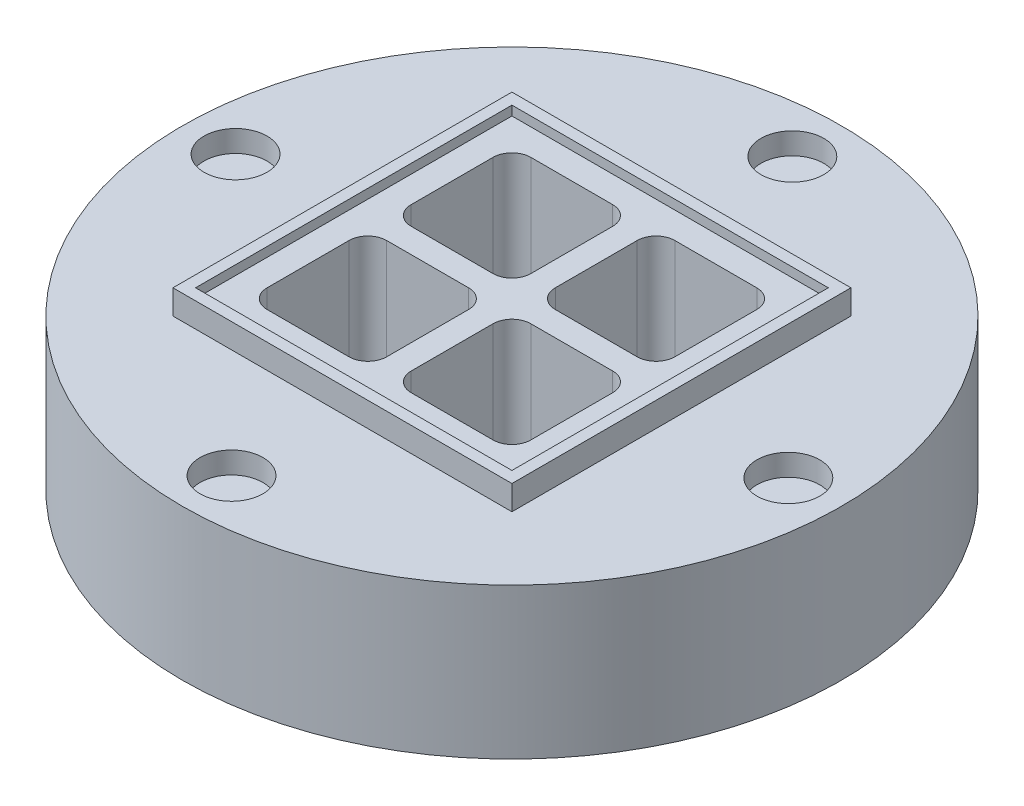
from build123d import *

# Parameters (mm, degrees)
SKETCH1_R           = 17.5
BOSS_EXTRUDE1_DEPTH = 8
SKETCH5_R           = 16.5
CUT_EXTRUDE2_DEPTH  = 1
SKETCH11_R          = 1.67
CUT_EXTRUDE5_DEPTH  = 1.15
CIRPATTERN1_COUNT   = 4
SKETCH13_W          = 18
SKETCH13_H          = 18
SKETCH13_W_2        = 16.8
SKETCH13_H_2        = 16.8
BOSS_EXTRUDE3_DEPTH = 1.3
SKETCH12_W          = 18
SKETCH12_H          = 18
SKETCH12_W_2        = 14
SKETCH12_H_2        = 14
SKETCH12_W_3        = 6.349092008
SKETCH12_H_3        = 1.301815984
SKETCH12_W_4        = 1.301815984
SKETCH12_H_4        = 6.349092008
BOSS_EXTRUDE2_DEPTH = 0.8
SKETCH14_W          = 6.349092008
SKETCH14_H          = 6.349092008
CUT_EXTRUDE6_DEPTH  = 27.009613607
FILLET1_R           = 1


with BuildPart() as part:
    # Sketch1 → Boss-Extrude1 (new body)
    with BuildSketch(Plane(origin=(0, 0, 0), x_dir=(1, 0, 0), z_dir=(0, 1, 0))):
        with Locations(Location((0, 0, 0), (0, 0, 270))):
            Circle(SKETCH1_R)
    extrude(amount=BOSS_EXTRUDE1_DEPTH)

    # Sketch5 → Cut-Extrude2 (cut)
    with BuildSketch(Plane.XZ):
        with Locations(Location((0, 0, 0), (0, 0, 270))):
            Circle(SKETCH5_R)
    extrude(amount=-CUT_EXTRUDE2_DEPTH, mode=Mode.SUBTRACT)

    # Sketch11 → Cut-Extrude5 (cut)
    with BuildSketch(Plane(origin=(0, 8, 0), x_dir=(1, 0, 0), z_dir=(0, 1, 0))):
        with Locations(Location((0.106708516, 14.783412681, 0), (0, 0, 270))):
            Circle(SKETCH11_R)
    cut_extrude5 = extrude(amount=-CUT_EXTRUDE5_DEPTH, mode=Mode.SUBTRACT)

    # CirPattern1: Cut-Extrude5 ×4 about axis
    cirpattern1_axis = Axis((0, 0, 0), (0, 1, 0))
    for i in range(1, CIRPATTERN1_COUNT):
        add(cut_extrude5.rotate(cirpattern1_axis, i * 360 / CIRPATTERN1_COUNT), mode=Mode.SUBTRACT)

    # Sketch13 → Boss-Extrude3 (add)
    with BuildSketch(Plane(origin=(0, 8, 0), x_dir=(1, 0, 0), z_dir=(0, 1, 0))):
        Rectangle(SKETCH13_W, SKETCH13_H)
        Rectangle(SKETCH13_W_2, SKETCH13_H_2, mode=Mode.SUBTRACT)
    extrude(amount=BOSS_EXTRUDE3_DEPTH)

    # Sketch12 → Boss-Extrude2 (add)
    # profile 1 of 6: a face of its own
    with BuildSketch(Plane(origin=(0, 8, 0), x_dir=(1, 0, 0), z_dir=(0, 1, 0))):
        Rectangle(SKETCH12_W, SKETCH12_H)
        Rectangle(SKETCH12_W_2, SKETCH12_H_2, mode=Mode.SUBTRACT)
    # profile 2 of 6: a face of its own
    with BuildSketch(Plane(origin=(0, 8, 0), x_dir=(1, 0, 0), z_dir=(0, 1, 0))):
        with Locations((-3.825453996, 0)):
            Rectangle(SKETCH12_W_3, SKETCH12_H_3)
    # profile 3 of 6: a face of its own
    with BuildSketch(Plane(origin=(0, 8, 0), x_dir=(1, 0, 0), z_dir=(0, 1, 0))):
        with Locations((0, 3.825453996)):
            Rectangle(SKETCH12_W_4, SKETCH12_H_4)
    # profile 4 of 6: a face of its own
    with BuildSketch(Plane(origin=(0, 8, 0), x_dir=(1, 0, 0), z_dir=(0, 1, 0))):
        with Locations((0, -3.825453996)):
            Rectangle(SKETCH12_W_4, SKETCH12_H_4)
    # profile 5 of 6: a face of its own
    with BuildSketch(Plane(origin=(0, 8, 0), x_dir=(1, 0, 0), z_dir=(0, 1, 0))):
        Rectangle(SKETCH12_W_4, SKETCH12_H_3)
    # profile 6 of 6: a face of its own
    with BuildSketch(Plane(origin=(0, 8, 0), x_dir=(1, 0, 0), z_dir=(0, 1, 0))):
        with Locations((3.825453996, 0)):
            Rectangle(SKETCH12_W_3, SKETCH12_H_3)
    extrude(amount=BOSS_EXTRUDE2_DEPTH)

    # Sketch14 → Cut-Extrude6 (cut, through all)
    with BuildSketch(Plane(origin=(0, 8, 0), x_dir=(1, 0, 0), z_dir=(0, 1, 0))):
        with Locations((-3.825453996, 3.825453996)):
            Rectangle(SKETCH14_W, SKETCH14_H)
        with Locations((-3.825453996, -3.825453996)):
            Rectangle(SKETCH14_W, SKETCH14_H)
        with Locations((3.825453996, -3.825453996)):
            Rectangle(SKETCH14_W, SKETCH14_H)
        with Locations((3.825453996, 3.825453996)):
            Rectangle(SKETCH14_W, SKETCH14_H)
    extrude(amount=-CUT_EXTRUDE6_DEPTH, mode=Mode.SUBTRACT)

    # Fillet1
    fillet1_edges = [part.edges().sort_by_distance(p)[0] for p in [
        (-7, 4.9, 0.650907992),
        (-0.650907992, 4.9, 0.650907992),
        (-0.650907992, 4.9, 7),
        (-0.650907992, 4.5, -7),
        (-0.650907992, 4.5, -0.650907992),
        (-7, 4.9, -0.650907992),
        (0.650907992, 4.9, 7),
        (0.650907992, 4.9, 0.650907992),
        (7, 4.5, 0.650907992),
        (7, 4.9, -0.650907992),
        (0.650907992, 4.9, -0.650907992),
        (0.650907992, 4.9, -7),
        (-7, 4.9, -7),
        (7, 4.5, 7),
        (7, 4.9, -7),
        (-7, 4.9, 7),
    ]]
    fillet(fillet1_edges, radius=FILLET1_R)


solid = part.part
